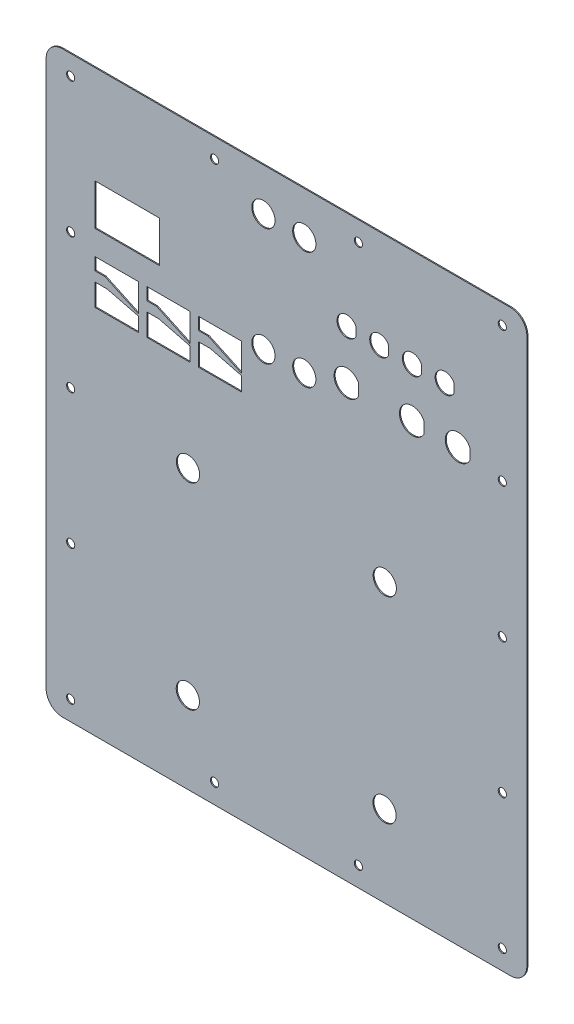
from build123d import *

# Parameters (mm, degrees)
SKETCH1_R           = 3.175
SKETCH1_R_2         = 9.03605
SKETCH1_W           = 49.9872
SKETCH1_H           = 31.9786
BOSS_EXTRUDE1_DEPTH = 0.79375


with BuildPart() as part:
    # Sketch1 → Boss-Extrude1 (new body)
    with BuildSketch(Plane.XY):
        with BuildLine():
            Line((174.136860842, 46.306847874), (-173.843139158, 46.306847874))
            ThreePointArc((-173.843139158, 46.306847874), (-182.823395279, 42.587103995), (-186.543139158, 33.606847874))
            Line((-186.543139158, 33.606847874), (-186.543139158, -390.573152126))
            ThreePointArc((-186.543139158, -390.573152126), (-182.823395279, -399.553408247), (-173.843139158, -403.273152126))
            Line((-173.843139158, -403.273152126), (174.136860842, -403.273152126))
            ThreePointArc((174.136860842, -403.273152126), (183.117116963, -399.553408247), (186.836860842, -390.573152126))
            Line((186.836860842, -390.573152126), (186.836860842, 33.606847874))
            ThreePointArc((186.836860842, 33.606847874), (183.117116963, 42.587103995), (174.136860842, 46.306847874))
        make_face()
        with Locations((-167.493139158, -388.033152126)):
            Circle(SKETCH1_R, mode=Mode.SUBTRACT)
        with Locations((-167.493139158, -283.258152126)):
            Circle(SKETCH1_R, mode=Mode.SUBTRACT)
        with Locations((-167.493139158, -178.483152126)):
            Circle(SKETCH1_R, mode=Mode.SUBTRACT)
        with Locations((-167.493139158, -73.708152126)):
            Circle(SKETCH1_R, mode=Mode.SUBTRACT)
        with Locations((-167.493139158, 31.066847874)):
            Circle(SKETCH1_R, mode=Mode.SUBTRACT)
        with Locations((-55.733139158, 31.066847874)):
            Circle(SKETCH1_R, mode=Mode.SUBTRACT)
        with Locations((56.026860842, 31.066847874)):
            Circle(SKETCH1_R, mode=Mode.SUBTRACT)
        with Locations((167.786860842, 31.066847874)):
            Circle(SKETCH1_R, mode=Mode.SUBTRACT)
        with Locations((167.786860842, -73.708152126)):
            Circle(SKETCH1_R, mode=Mode.SUBTRACT)
        with Locations((167.786860842, -178.483152126)):
            Circle(SKETCH1_R, mode=Mode.SUBTRACT)
        with Locations((167.786860842, -283.258152126)):
            Circle(SKETCH1_R, mode=Mode.SUBTRACT)
        with Locations((167.786860842, -388.033152126)):
            Circle(SKETCH1_R, mode=Mode.SUBTRACT)
        with Locations((56.026860842, -388.033152126)):
            Circle(SKETCH1_R, mode=Mode.SUBTRACT)
        with Locations((-55.733139158, -388.033152126)):
            Circle(SKETCH1_R, mode=Mode.SUBTRACT)
        with Locations((-76.479037871, -339.905329155)):
            Circle(SKETCH1_R_2, mode=Mode.SUBTRACT)
        with Locations((-76.332177029, -187.094114255)):
            Circle(SKETCH1_R_2, mode=Mode.SUBTRACT)
        with Locations((76.479037871, -187.240975097)):
            Circle(SKETCH1_R_2, mode=Mode.SUBTRACT)
        with Locations((76.332177029, -340.052189997)):
            Circle(SKETCH1_R_2, mode=Mode.SUBTRACT)
        with Locations((13.97, -77.772152126)):
            Circle(SKETCH1_R_2, mode=Mode.SUBTRACT)
        with Locations((-17.78, -77.772152126)):
            Circle(SKETCH1_R_2, mode=Mode.SUBTRACT)
        with Locations((-17.78, 13.286847874)):
            Circle(SKETCH1_R_2, mode=Mode.SUBTRACT)
        with Locations((13.97, 13.286847874)):
            Circle(SKETCH1_R_2, mode=Mode.SUBTRACT)
        with Locations((-123.449539158, -45.882452126)):
            Rectangle(SKETCH1_W, SKETCH1_H, mode=Mode.SUBTRACT)
        Polygon((-114.870386547, -115.040351359), (-114.870386547, -104.031104561), (-139.177931457, -97.926967723), (-148.443139158, -97.926967723), (-148.443139158, -115.040351359), align=None, mode=Mode.SUBTRACT)
        Polygon((-68.280739158, -90.405799119), (-60.65056811, -90.405799119), (-34.707986547, -102.505070352), (-34.707986547, -80.813584087), (-68.280739158, -80.813584087), align=None, mode=Mode.SUBTRACT)
        Polygon((-74.789186547, -115.040351359), (-74.789186547, -104.031104561), (-99.096731457, -97.926967723), (-108.361939158, -97.926967723), (-108.361939158, -115.040351359), align=None, mode=Mode.SUBTRACT)
        Polygon((-74.789186547, -102.505070352), (-74.789186547, -80.813584087), (-108.361939158, -80.813584087), (-108.361939158, -90.405799119), (-100.73176811, -90.405799119), align=None, mode=Mode.SUBTRACT)
        Polygon((-59.015531457, -97.926967723), (-68.280739158, -97.926967723), (-68.280739158, -115.040351359), (-34.707986547, -115.040351359), (-34.707986547, -104.031104561), align=None, mode=Mode.SUBTRACT)
        Polygon((-148.443139158, -80.813584087), (-148.443139158, -90.405799119), (-140.81296811, -90.405799119), (-114.870386547, -102.505070352), (-114.870386547, -80.813584087), align=None, mode=Mode.SUBTRACT)
        with BuildLine():
            Line((56.153860842, -72.392561177), (56.153860842, -63.593743074))
            ThreePointArc((56.153860842, -63.593743074), (37.103860842, -67.993152126), (56.153860842, -72.392561177))
        make_face(mode=Mode.SUBTRACT)
        with BuildLine():
            Line((106.953860842, -72.392561177), (106.953860842, -63.593743074))
            ThreePointArc((106.953860842, -63.593743074), (87.903860842, -67.993152126), (106.953860842, -72.392561177))
        make_face(mode=Mode.SUBTRACT)
        with BuildLine():
            Line((142.513860842, -72.392561177), (142.513860842, -63.593743074))
            ThreePointArc((142.513860842, -63.593743074), (123.463860842, -67.993152126), (142.513860842, -72.392561177))
        make_face(mode=Mode.SUBTRACT)
        with BuildLine():
            Line((130.372660842, -33.13560912), (130.372660842, -26.650695131))
            ThreePointArc((130.372660842, -26.650695131), (115.589860842, -29.893152126), (130.372660842, -33.13560912))
        make_face(mode=Mode.SUBTRACT)
        with BuildLine():
            Line((104.972660842, -33.13560912), (104.972660842, -26.650695131))
            ThreePointArc((104.972660842, -26.650695131), (90.189860842, -29.893152126), (104.972660842, -33.13560912))
        make_face(mode=Mode.SUBTRACT)
        with BuildLine():
            Line((79.572660842, -33.13560912), (79.572660842, -26.650695131))
            ThreePointArc((79.572660842, -26.650695131), (64.789860842, -29.893152126), (79.572660842, -33.13560912))
        make_face(mode=Mode.SUBTRACT)
        with BuildLine():
            Line((54.172660842, -33.13560912), (54.172660842, -26.650695131))
            ThreePointArc((54.172660842, -26.650695131), (39.389860842, -29.893152126), (54.172660842, -33.13560912))
        make_face(mode=Mode.SUBTRACT)
    extrude(amount=BOSS_EXTRUDE1_DEPTH)


solid = part.part
